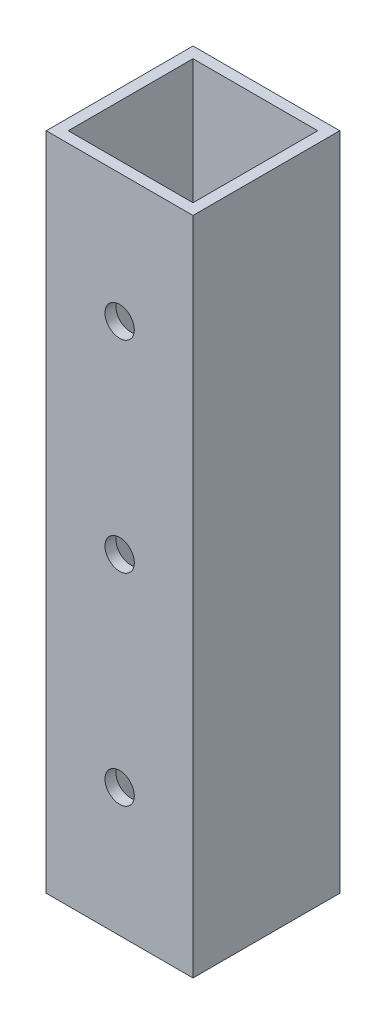
from build123d import *

# Parameters (mm, degrees)
SKETCH_1_W          = 20
SKETCH_1_H          = 20
SKETCH_1_W_2        = 17
SKETCH_1_H_2        = 17
EXTRUDE_1_DEPTH     = 90
SKETCH_2_R          = 2
CUT_EXTRUDE_1_DEPTH = 100


with BuildPart() as part:
    # 草图1 → 凸台-拉伸1 (new body)
    with BuildSketch(Plane(origin=(0, 0, 0), x_dir=(1, 0, 0), z_dir=(0, 1, 0))):
        Rectangle(SKETCH_1_W, SKETCH_1_H)
        Rectangle(SKETCH_1_W_2, SKETCH_1_H_2, mode=Mode.SUBTRACT)
    extrude(amount=EXTRUDE_1_DEPTH)

    # 草图2 → 切除-拉伸1 (cut)
    with BuildSketch(Plane(origin=(0, 0, -10), x_dir=(-1, 0, 0), z_dir=(0, 0, -1))):
        with Locations((0, 72.5)):
            Circle(SKETCH_2_R)
        with Locations((0, 17.5)):
            Circle(SKETCH_2_R)
        with Locations((0, 45)):
            Circle(SKETCH_2_R)
    extrude(amount=-CUT_EXTRUDE_1_DEPTH, mode=Mode.SUBTRACT)


solid = part.part
